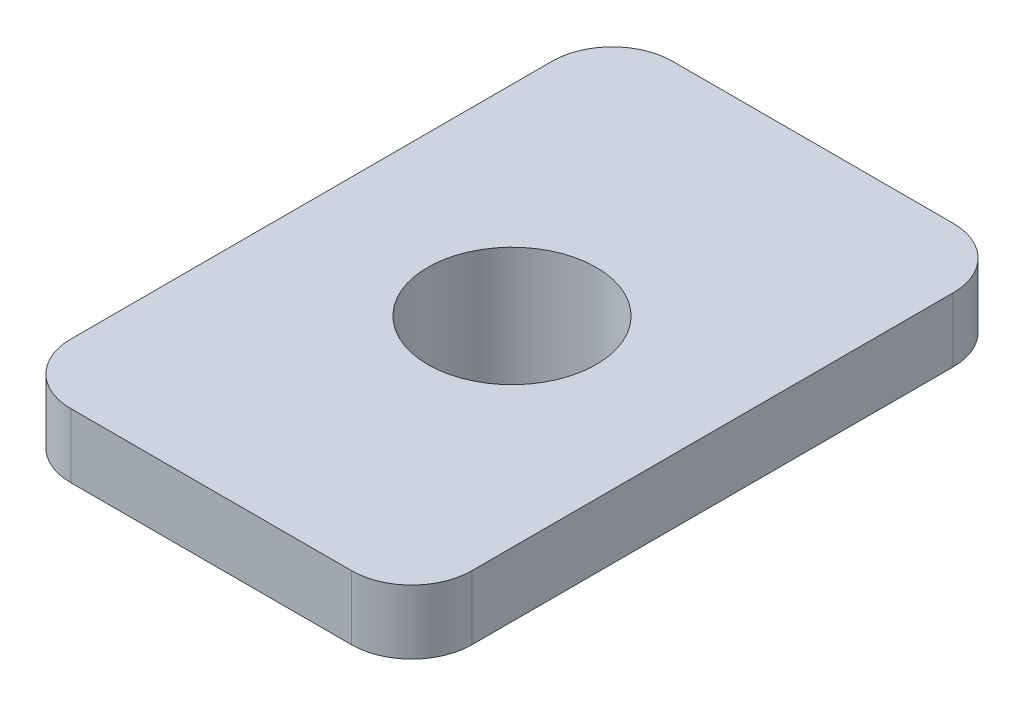
from build123d import *

# Parameters (mm, degrees)
SKETCH1_W             = 10
SKETCH1_H             = 15
BOSS_EXTRUDE1_DEPTH   = 1.6
FILLET1_R             = 1.5
SKETCH2_R             = 3.45
BOSS_EXTRUDE2_DEPTH   = 1.4
M5X0_8_TAPPED_HOLE1_D = 4.2
FILLET2_R             = 0.4


with BuildPart() as part:
    # Sketch1 → Boss-Extrude1 (new body)
    with BuildSketch(Plane(origin=(0, 0, 0), x_dir=(1, 0, 0), z_dir=(0, 1, 0))):
        with Locations((5, 7.5)):
            Rectangle(SKETCH1_W, SKETCH1_H)
    extrude(amount=BOSS_EXTRUDE1_DEPTH)

    # Fillet1
    fillet1_edges = [part.edges().sort_by_distance(p)[0] for p in [
        (0, 0.8, -15),
        (10, 0.8, -15),
        (10, 0.8, 0),
        (0, 0.8, 0),
    ]]
    fillet(fillet1_edges, radius=FILLET1_R)

    # Sketch2 → Boss-Extrude2 (add)
    with BuildSketch(Plane.XZ):
        with Locations(Location((5, -7.5, 0), (0, 0, 270))):
            Circle(SKETCH2_R)
    extrude(amount=BOSS_EXTRUDE2_DEPTH)

    # M5x0.8 Tapped Hole1 (through all)
    with Locations(Plane(origin=(0, 1.6, 0), x_dir=(1, 0, 0), z_dir=(0, 1, 0))):
        with Locations((5, 7.5)):
            Hole(M5X0_8_TAPPED_HOLE1_D / 2)

    # Fillet2
    fillet2_edges = [part.edges().sort_by_distance(p)[0] for p in [
        (5, 0, -4.05),
    ]]
    fillet(fillet2_edges, radius=FILLET2_R)


solid = part.part
